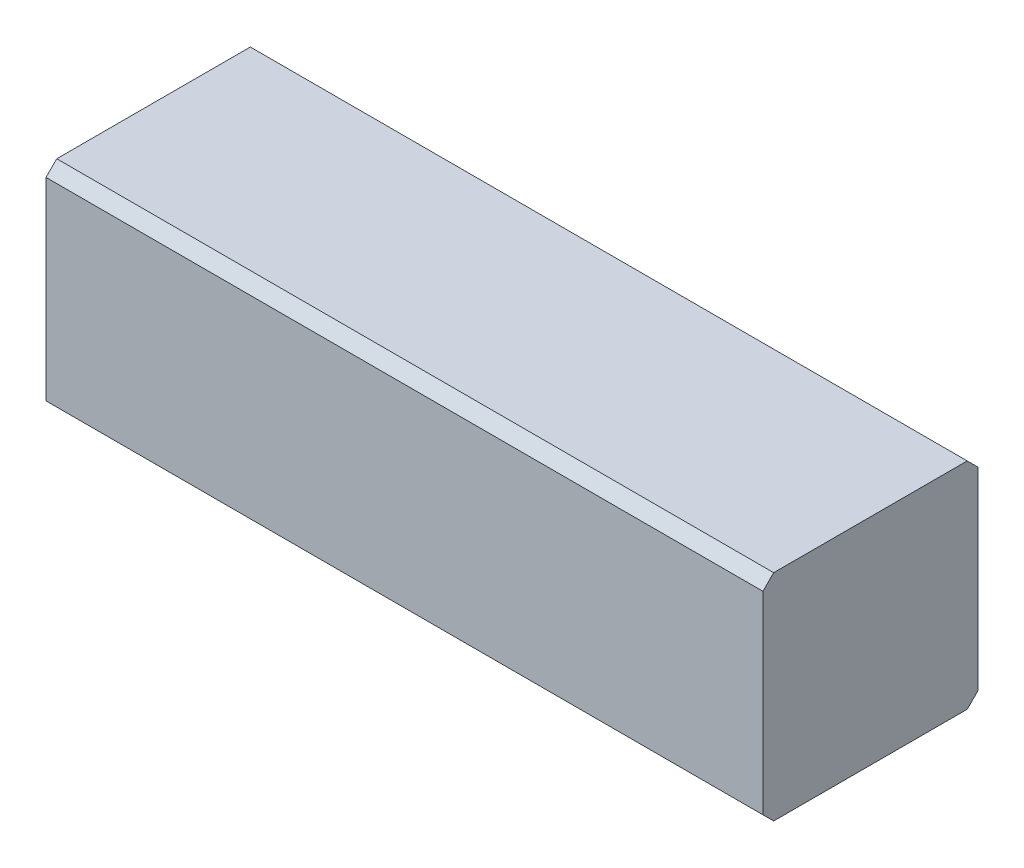
from build123d import *

# Parameters (mm, degrees)
BOSS_EXTRUDE1_DEPTH = 10


with BuildPart() as part:
    # Sketch1 → Boss-Extrude1 (new body)
    with BuildSketch(Plane(origin=(0, 0, 0), x_dir=(0, 0, -1), z_dir=(1, 0, 0))):
        Polygon((-1.35, 1.5), (-1.5, 1.35), (-1.5, -1.35), (-1.35, -1.5), (1.35, -1.5), (1.5, -1.35), (1.5, 1.35), (1.35, 1.5), align=None)
    extrude(amount=BOSS_EXTRUDE1_DEPTH)


solid = part.part
